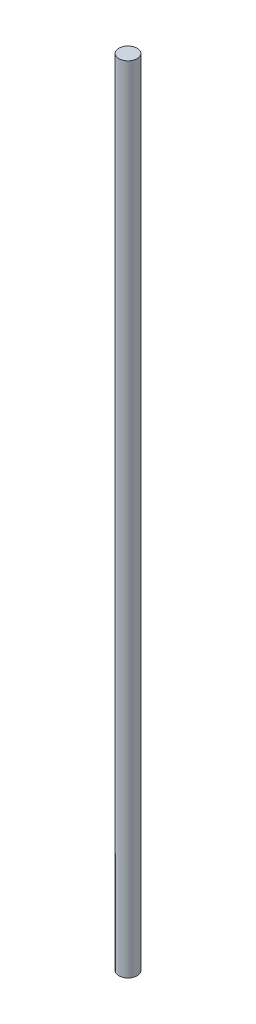
from build123d import *

# Parameters (mm, degrees)
SKETCH1_R           = 4.2
BOSS_EXTRUDE1_DEPTH = 366.8


with BuildPart() as part:
    # Sketch1 → Boss-Extrude1 (new body)
    with BuildSketch(Plane(origin=(0, 0, 0), x_dir=(1, 0, 0), z_dir=(0, 1, 0))):
        with Locations(Location((0, 0, 0), (0, 0, 270))):
            Circle(SKETCH1_R)
    extrude(amount=BOSS_EXTRUDE1_DEPTH)


solid = part.part
